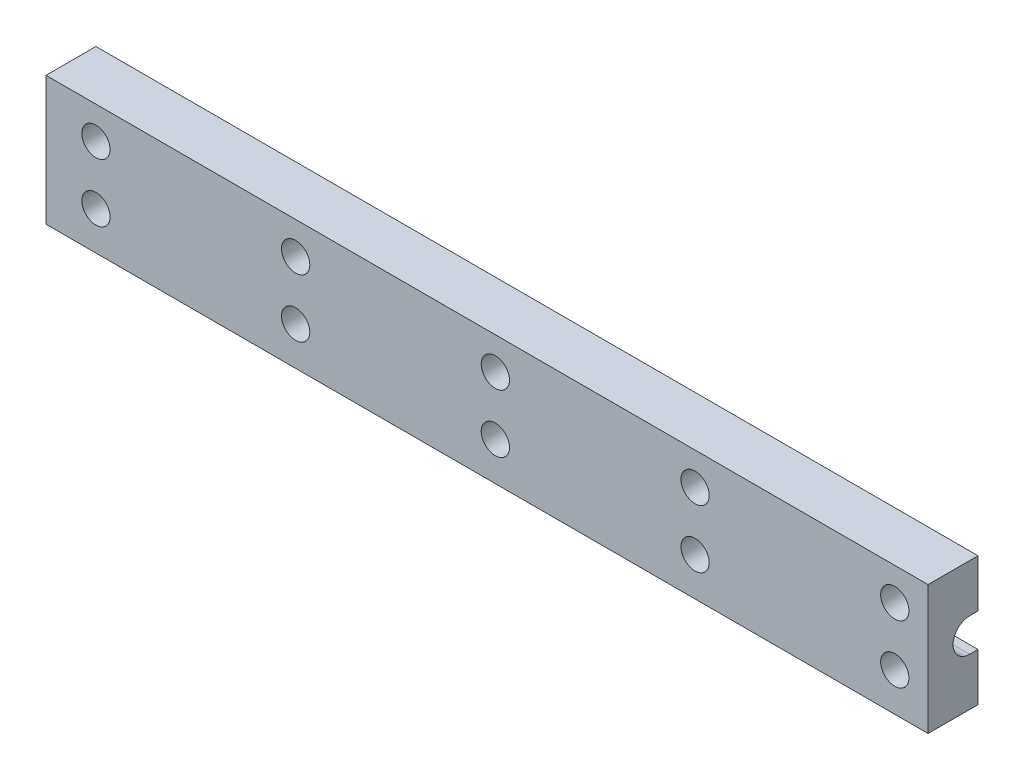
from build123d import *

# Parameters (mm, degrees)
BOSS_EXTRUDE1_DEPTH      = 60
BOSS_EXTRUDE1_DEPTH_BACK = 46
SKETCH2_R                = 1.7
CUT_EXTRUDE1_DEPTH       = 10


with BuildPart() as part:
    # Sketch1 → Boss-Extrude1 (new, two sides: drawn at the far end of the back side and taken through both)
    with BuildSketch(Plane(origin=(190.645148, 0, 0), x_dir=(0, 0, -1), z_dir=(1, 0, 0)).offset(-BOSS_EXTRUDE1_DEPTH_BACK)):
        with BuildLine():
            Line((-240.970904961, 189.163538159), (-246.970904961, 189.163538159))
            Line((-246.970904961, 189.163538159), (-246.970904961, 173.663538158))
            Line((-246.970904961, 173.663538158), (-240.970904961, 173.663538158))
            Line((-240.970904961, 173.663538158), (-240.970904961, 179.413538158))
            Line((-240.970904961, 179.413538158), (-241.970904961, 179.413538158))
            ThreePointArc((-241.970904961, 179.413538158), (-243.970904961, 181.413538158), (-241.970904961, 183.413538158))
            Line((-241.970904961, 183.413538158), (-240.970904961, 183.413538158))
            Line((-240.970904961, 183.413538158), (-240.970904961, 189.163538159))
        make_face()
    extrude(amount=BOSS_EXTRUDE1_DEPTH + BOSS_EXTRUDE1_DEPTH_BACK)

    # Sketch2 → Cut-Extrude1 (cut)
    with BuildSketch(Plane.XY.offset(246.970904961)):
        with BuildLine():
            ThreePointArc((176.345148, 178.278360264), (174.645148, 179.978360264), (172.945148, 178.278360264))
            ThreePointArc((172.945148, 178.278360264), (174.645148, 176.578360264), (176.345148, 178.278360264))
        make_face()
        with BuildLine():
            ThreePointArc((152.345148, 178.278360264), (149.443066472, 179.480441792), (150.645148, 176.578360264))
            Line((150.645148, 176.578360264), (150.645148, 178.278360264))
            Line((150.645148, 178.278360264), (152.345148, 178.278360264))
        make_face()
        with BuildLine():
            Line((150.645148, 178.278360264), (150.645148, 176.578360264))
            ThreePointArc((150.645148, 176.578360264), (151.847229528, 177.076278736), (152.345148, 178.278360264))
            Line((152.345148, 178.278360264), (150.645148, 178.278360264))
        make_face()
        with BuildLine():
            ThreePointArc((152.345148, 185.288538158), (150.645148, 186.988538158), (148.945148, 185.288538158))
            Line((148.945148, 185.288538158), (150.645148, 185.288538158))
            Line((150.645148, 185.288538158), (152.345148, 185.288538158))
        make_face()
        with BuildLine():
            Line((150.645148, 185.288538158), (148.945148, 185.288538158))
            ThreePointArc((148.945148, 185.288538158), (150.644787533, 183.588538197), (152.345147847, 185.287817224))
            Line((152.345147847, 185.287817224), (150.645148, 185.288538158))
        make_face()
        with BuildLine():
            Line((152.345148, 185.288538158), (150.645148, 185.288538158))
            Line((150.645148, 185.288538158), (152.345147847, 185.287817224))
            ThreePointArc((152.345147847, 185.287817224), (152.345147962, 185.288177691), (152.345148, 185.288538158))
        make_face()
        with BuildLine():
            ThreePointArc((176.345148, 185.278360264), (175.847229528, 186.480441792), (174.645148, 186.978360264))
            Line((174.645148, 186.978360264), (174.645148, 185.278360264))
            Line((174.645148, 185.278360264), (172.945148153, 185.279081198))
            ThreePointArc((172.945148153, 185.279081198), (174.644787533, 183.578360302), (176.345148, 185.278360264))
        make_face()
        with BuildLine():
            Line((174.645148, 185.278360264), (174.645148, 186.978360264))
            ThreePointArc((174.645148, 186.978360264), (173.446670303, 186.484034851), (172.945178468, 185.288538158))
            ThreePointArc((172.945178468, 185.288538158), (172.945156734, 185.283809699), (172.945148153, 185.279081198))
            Line((172.945148153, 185.279081198), (174.645148, 185.278360264))
        make_face()
        with Locations((198.645148, 178.278360264)):
            Circle(SKETCH2_R)
        with Locations((246.645148, 185.278360264)):
            Circle(SKETCH2_R)
        with Locations((246.645148, 178.278360264)):
            Circle(SKETCH2_R)
        with Locations((222.645148, 185.278360264)):
            Circle(SKETCH2_R)
        with Locations((222.645148, 178.278360264)):
            Circle(SKETCH2_R)
        with Locations((198.645148, 185.278360264)):
            Circle(SKETCH2_R)
    extrude(amount=-CUT_EXTRUDE1_DEPTH, mode=Mode.SUBTRACT)


solid = part.part
